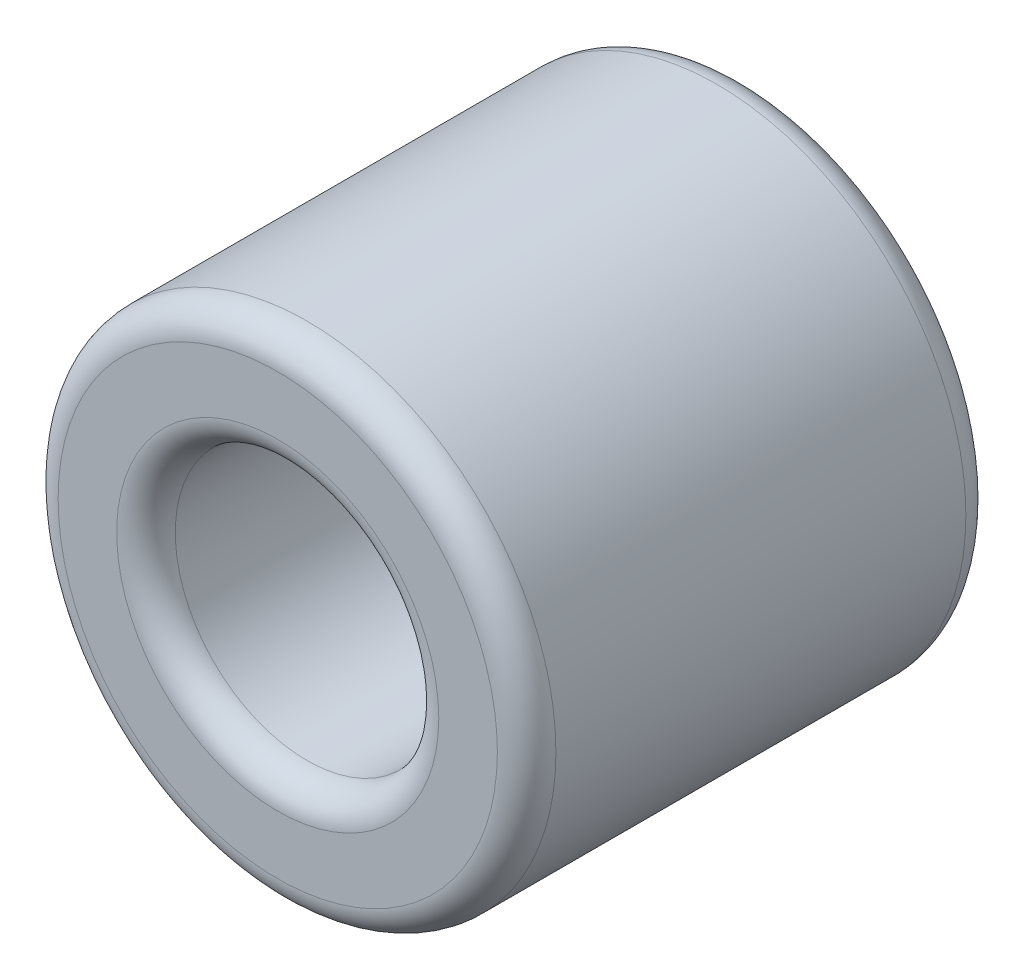
from build123d import *

# Parameters (mm, degrees)
SKETCH1_R           = 4.25
SKETCH1_R_2         = 2.25
BOSS_EXTRUDE1_DEPTH = 8
FILLET1_R           = 0.5


with BuildPart() as part:
    # Sketch1 → Boss-Extrude1 (new body)
    with BuildSketch(Plane.XY):
        Circle(SKETCH1_R)
        Circle(SKETCH1_R_2, mode=Mode.SUBTRACT)
    extrude(amount=BOSS_EXTRUDE1_DEPTH)

    # Fillet1
    fillet1_edges = [part.edges().sort_by_distance(p)[0] for p in [
        (-4.25, 0, 0),
        (-4.25, 0, 8),
        (-2.25, 0, 0),
        (-2.25, 0, 8),
    ]]
    fillet(fillet1_edges, radius=FILLET1_R)


solid = part.part
